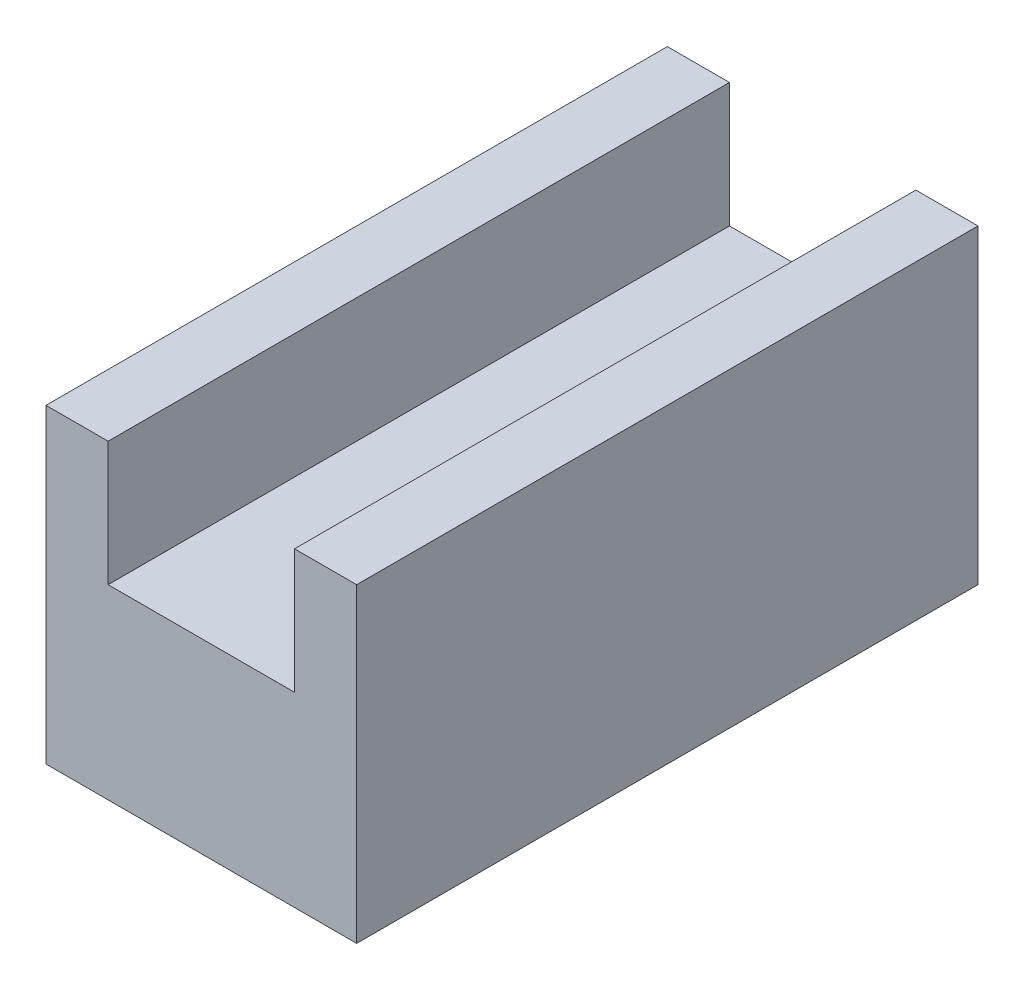
from build123d import *

# Parameters (mm, degrees)
SKETCH1_W           = 5
SKETCH1_H           = 5
BOSS_EXTRUDE1_DEPTH = 10
SKETCH2_W           = 3
SKETCH2_H           = 10
CUT_EXTRUDE1_DEPTH  = 2


with BuildPart() as part:
    # Sketch1 → Boss-Extrude1 (new body)
    with BuildSketch(Plane.XY):
        with Locations((2.5, 2.5)):
            Rectangle(SKETCH1_W, SKETCH1_H)
    extrude(amount=BOSS_EXTRUDE1_DEPTH)

    # Sketch2 → Cut-Extrude1 (cut)
    with BuildSketch(Plane(origin=(0, 5, 0), x_dir=(1, 0, 0), z_dir=(0, 1, 0))):
        with Locations((2.5, -5)):
            Rectangle(SKETCH2_W, SKETCH2_H)
    extrude(amount=-CUT_EXTRUDE1_DEPTH, mode=Mode.SUBTRACT)


solid = part.part
